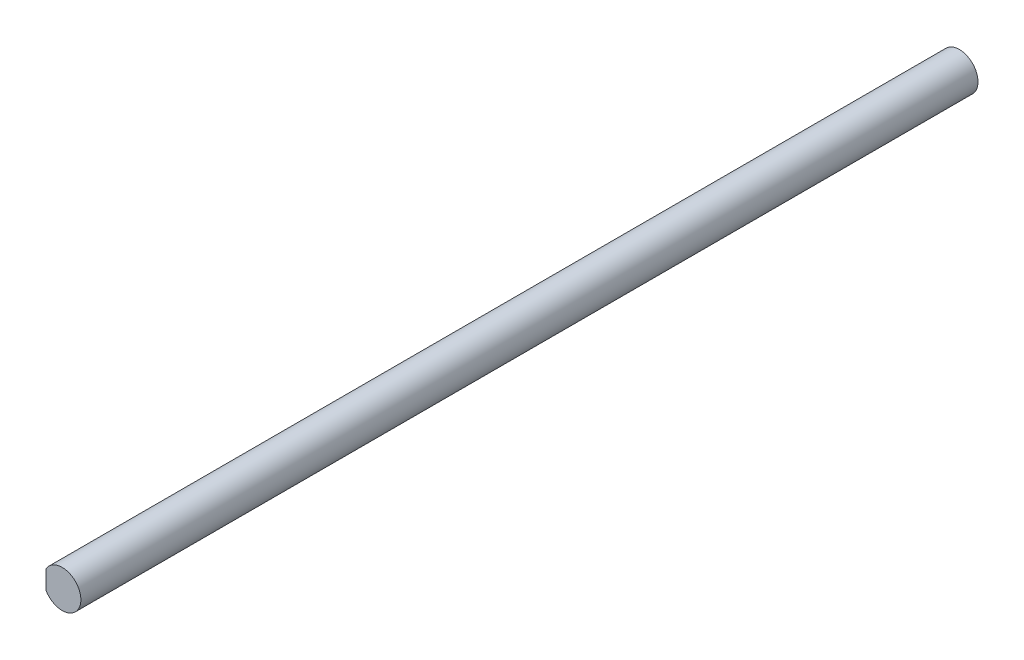
from build123d import *

# Parameters (mm, degrees)
BOSS_EXTRUDE1_DEPTH = 152.4


with BuildPart() as part:
    # Sketch2 → Boss-Extrude1 (new body)
    with BuildSketch(Plane.XY):
        with BuildLine():
            Line((-2.749630657, 1.5875), (-2.749630657, -1.5875))
            ThreePointArc((-2.749630657, -1.5875), (3.175, 0), (-2.749630657, 1.5875))
        make_face()
    extrude(amount=BOSS_EXTRUDE1_DEPTH)


solid = part.part
